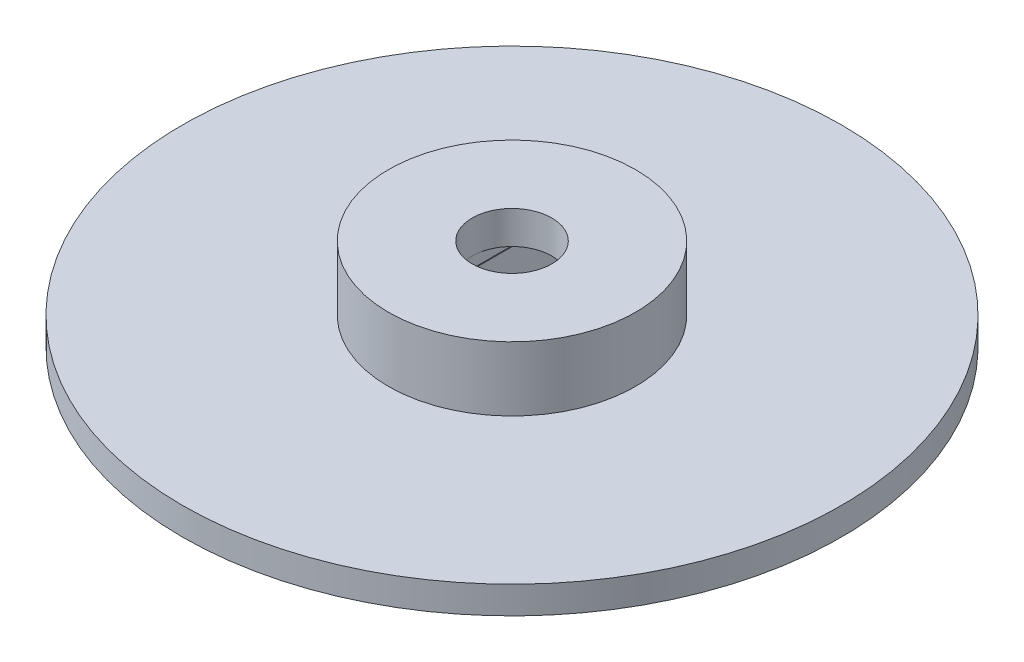
from build123d import *

# Parameters (mm, degrees)
SKETCH1_R           = 60
BOSS_EXTRUDE1_DEPTH = 5
SKETCH2_R           = 22.5
BOSS_EXTRUDE3_DEPTH = 11.7
SKETCH6_R           = 7.25
CUT_EXTRUDE4_DEPTH  = 6
SKETCH7_W           = 14.5
SKETCH7_H           = 22.8
CUT_EXTRUDE5_DEPTH  = 2
SKETCH9_W           = 14.5
SKETCH9_H           = 31.8
CUT_EXTRUDE6_DEPTH  = 25


with BuildPart() as part:
    # Sketch1 → Boss-Extrude1 (new body)
    with BuildSketch(Plane(origin=(0, 0, 0), x_dir=(1, 0, 0), z_dir=(0, 1, 0))):
        with Locations(Location((0, 0, 0), (0, 0, 270))):
            Circle(SKETCH1_R)
    extrude(amount=BOSS_EXTRUDE1_DEPTH)

    # Sketch2 → Boss-Extrude3 (add)
    with BuildSketch(Plane(origin=(0, 5, 0), x_dir=(1, 0, 0), z_dir=(0, 1, 0))):
        with Locations(Location((0, 0, 0), (0, 0, 270))):
            Circle(SKETCH2_R)
    extrude(amount=BOSS_EXTRUDE3_DEPTH)

    # Sketch6 → Cut-Extrude4 (cut)
    with BuildSketch(Plane(origin=(0, 16.7, 0), x_dir=(1, 0, 0), z_dir=(0, 1, 0))):
        with Locations(Location((0, 0, 0), (0, 0, 270))):
            Circle(SKETCH6_R)
    extrude(amount=-CUT_EXTRUDE4_DEPTH, mode=Mode.SUBTRACT)

    # Sketch7 → Cut-Extrude5 (cut)
    with BuildSketch(Plane(origin=(0, 10.7, 0), x_dir=(1, 0, 0), z_dir=(0, 1, 0))):
        with Locations((0, 4.15)):
            Rectangle(SKETCH7_W, SKETCH7_H)
    extrude(amount=-CUT_EXTRUDE5_DEPTH, mode=Mode.SUBTRACT)

    # Sketch9 → Cut-Extrude6 (cut)
    with BuildSketch(Plane(origin=(0, 8.7, 0), x_dir=(1, 0, 0), z_dir=(0, 1, 0))):
        with Locations((0.153398413, 4.15)):
            Rectangle(SKETCH9_W, SKETCH9_H)
    extrude(amount=-CUT_EXTRUDE6_DEPTH, mode=Mode.SUBTRACT)


solid = part.part
